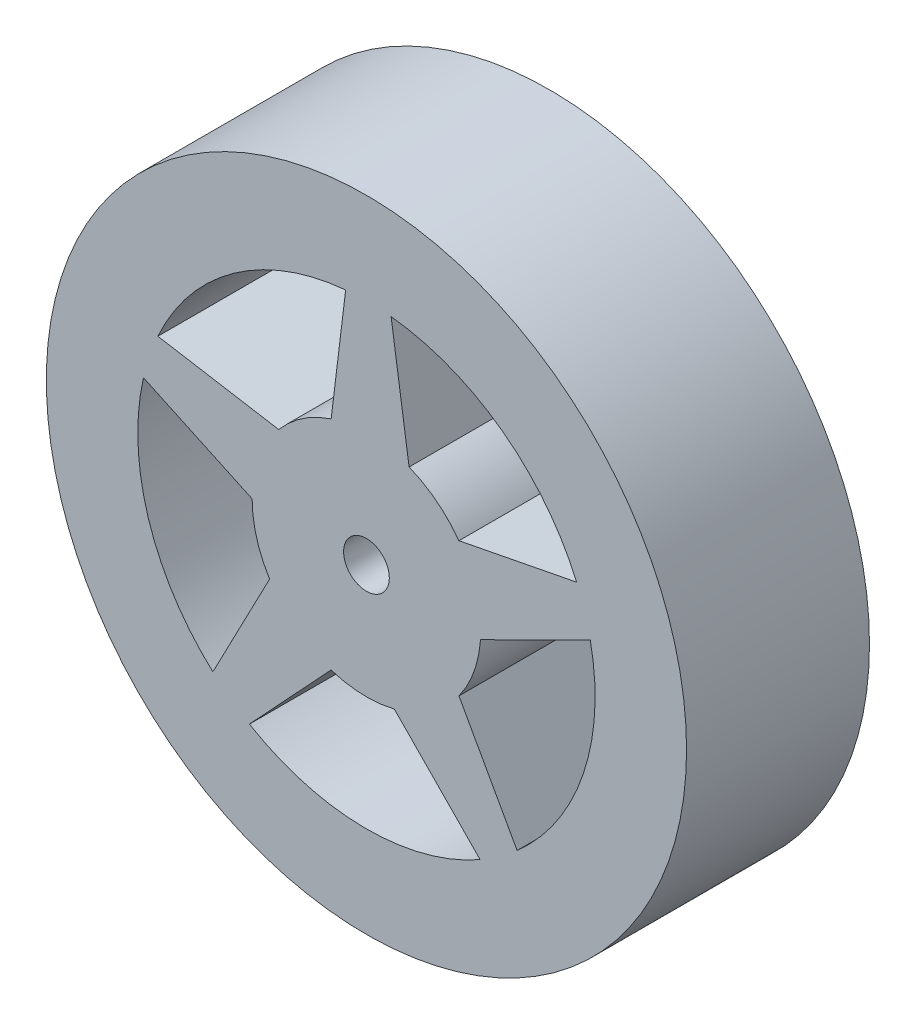
from build123d import *

# Parameters (mm, degrees)
SKETCH_1_R               = 35
SKETCH_1_R_2             = 25
EXTRUDE_1_DEPTH          = 10
SKETCH_2_R               = 12.5
EXTRUDE_2_DEPTH          = 10
PATTERN_CIRCULAR_1_COUNT = 5
SKETCH_3_R               = 2.5
CUT_EXTRUDE_1_DEPTH      = 54.38539126


with BuildPart() as part:
    # 草图1 → 凸台-拉伸1 (new, symmetric)
    with BuildSketch(Plane.XY):
        Circle(SKETCH_1_R)
        Circle(SKETCH_1_R_2, mode=Mode.SUBTRACT)
    extrude(amount=EXTRUDE_1_DEPTH, both=True)

    # 草图2 → 凸台-拉伸2 (add, symmetric)
    with BuildSketch(Plane.XY):
        Circle(SKETCH_2_R)
        with BuildLine():
            Line((-1.438766033, 31.712801318), (-3.859353097, 11.889297443))
            ThreePointArc((-3.859353097, 11.889297443), (0.427174783, 12.492698736), (4.662473362, 11.597902489))
            Line((4.662473362, 11.597902489), (1.678560372, 31.712801318))
            Line((1.678560372, 31.712801318), (-1.438766033, 31.712801318))
        make_face()
    extrude_2 = extrude(amount=EXTRUDE_2_DEPTH, both=True)

    # 阵列(圆周)1: 凸台-拉伸2 ×5 about axis
    pattern_circular_1_axis = Axis((0, 0, 0), (0, 0, 1))
    for i in range(1, PATTERN_CIRCULAR_1_COUNT):
        add(extrude_2.rotate(pattern_circular_1_axis, i * 360 / PATTERN_CIRCULAR_1_COUNT))

    # 草图3 → 切除-拉伸1 (cut, through all)
    with BuildSketch(Plane.XY.offset(10)):
        Circle(SKETCH_3_R)
    extrude(amount=-CUT_EXTRUDE_1_DEPTH, mode=Mode.SUBTRACT)


solid = part.part
